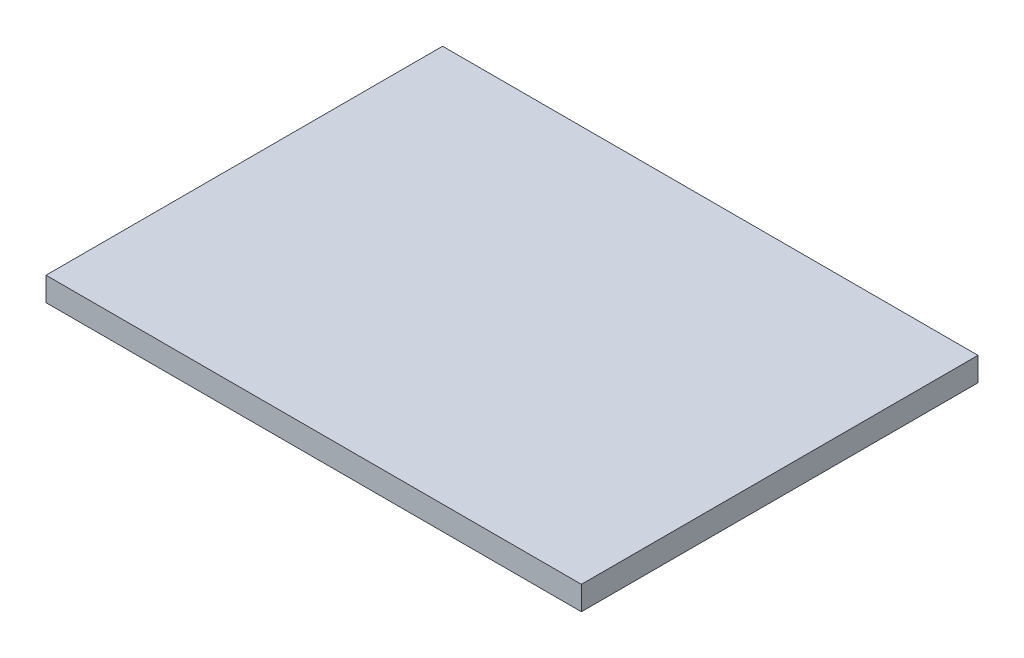
from build123d import *

# Parameters (mm, degrees)
SKETCH_1_W      = 27
SKETCH_1_H      = 20
EXTRUDE_1_DEPTH = 1.2


with BuildPart() as part:
    # 草图1 → 凸台-拉伸1 (new body)
    with BuildSketch(Plane(origin=(0, 0, 0), x_dir=(1, 0, 0), z_dir=(0, 1, 0))):
        with Locations((13.5, 10)):
            Rectangle(SKETCH_1_W, SKETCH_1_H)
    extrude(amount=EXTRUDE_1_DEPTH)


solid = part.part
